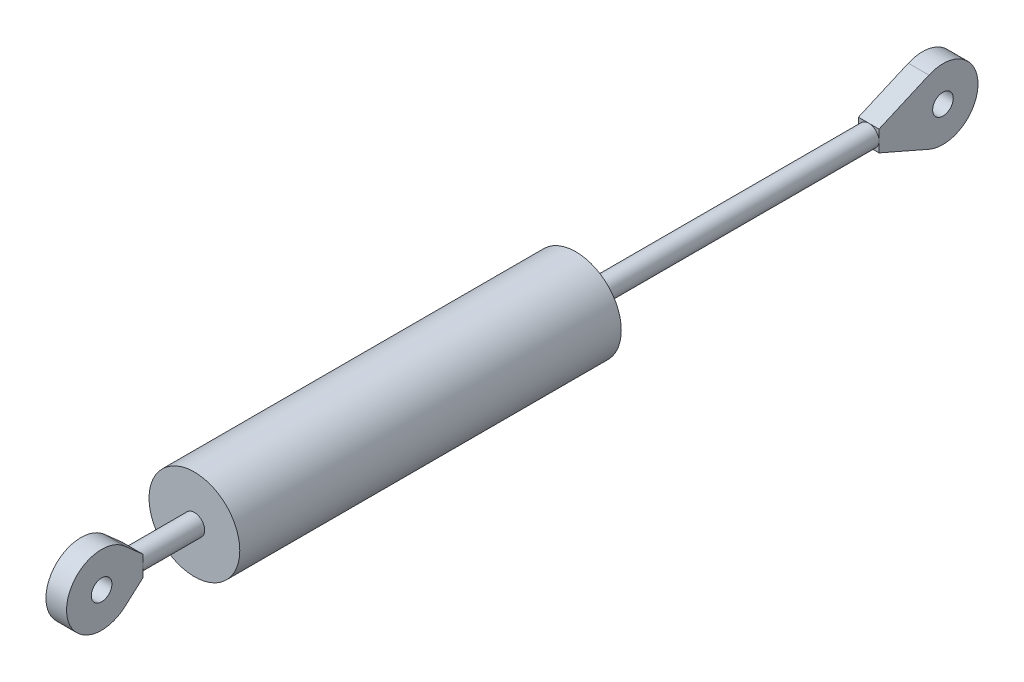
from build123d import *

# Parameters (mm, degrees)
SKETCH1_W                = 92.5
SKETCH1_H                = 11
SKETCH2_R                = 2.5
BOSS_EXTRUDE1_DEPTH      = 15
BOSS_EXTRUDE2_DEPTH      = 2.5
BOSS_EXTRUDE2_DEPTH_BACK = 2.5
SKETCH3_R                = 2.5
BOSS_EXTRUDE3_START      = 71
SKETCH4_R                = 2.5
BOSS_EXTRUDE3_DEPTH      = 71
BOSS_EXTRUDE4_DEPTH      = 2.5
BOSS_EXTRUDE4_DEPTH_BACK = 2.5
SKETCH5_R                = 2.5


with BuildPart() as part:
    # Sketch1 → Revolve1 (revolve)
    with BuildSketch(Plane(origin=(0, 0, 0), x_dir=(0, 0, -1), z_dir=(1, 0, 0)), mode=Mode.PRIVATE) as revolve1_sk:
        with Locations((0, 5.5)):
            Rectangle(SKETCH1_W, SKETCH1_H)
    revolve(revolve1_sk.sketch.rotate(Axis((0, 0, 46.25), (0, 0, -1)), 90), axis=Axis((0, 0, 46.25), (0, 0, -1)))

    # Sketch2 → Boss-Extrude1 (add)
    with BuildSketch(Plane.XY.offset(46.25)):
        Circle(SKETCH2_R)
    extrude(amount=BOSS_EXTRUDE1_DEPTH)

    # Sketch3 → Boss-Extrude2 (add, two sides: drawn at the far end of the back side and taken through both)
    with BuildSketch(Plane(origin=(0, 0, 0), x_dir=(0, 0, -1), z_dir=(1, 0, 0)).offset(-BOSS_EXTRUDE2_DEPTH_BACK)):
        with BuildLine():
            Line((-61.25, 2.5), (-65.616190379, 6.364761516))
            ThreePointArc((-65.616190379, 6.364761516), (-79.75, 0), (-65.616190379, -6.364761516))
            Line((-65.616190379, -6.364761516), (-61.25, -2.5))
            Line((-61.25, -2.5), (-61.25, 2.5))
        make_face()
        with Locations((-71.25, 0)):
            Circle(SKETCH3_R, mode=Mode.SUBTRACT)
    extrude(amount=BOSS_EXTRUDE2_DEPTH + BOSS_EXTRUDE2_DEPTH_BACK)

    # Sketch4 → Boss-Extrude3 (add)
    with BuildSketch(Plane(origin=(0, 0, -46.25), x_dir=(-1, 0, 0), z_dir=(0, 0, -1)).offset(BOSS_EXTRUDE3_START)):
        with Locations(Location((0, 0, 0), (0, 0, 180))):
            Circle(SKETCH4_R)
    extrude(amount=-BOSS_EXTRUDE3_DEPTH)

    # Sketch5 → Boss-Extrude4 (add, two sides: drawn at the far end of the back side and taken through both)
    with BuildSketch(Plane(origin=(0, 0, 0), x_dir=(0, 0, -1), z_dir=(1, 0, 0)).offset(-BOSS_EXTRUDE4_DEPTH_BACK)):
        with BuildLine():
            Line((117.25, 2.5), (129.34486024, 7.788133487))
            ThreePointArc((129.34486024, 7.788133487), (141.25, 0), (129.34486024, -7.788133487))
            Line((129.34486024, -7.788133487), (117.25, -2.5))
            Line((117.25, -2.5), (117.25, 2.5))
        make_face()
        with Locations((132.75, 0)):
            Circle(SKETCH5_R, mode=Mode.SUBTRACT)
    extrude(amount=BOSS_EXTRUDE4_DEPTH + BOSS_EXTRUDE4_DEPTH_BACK)


solid = part.part
